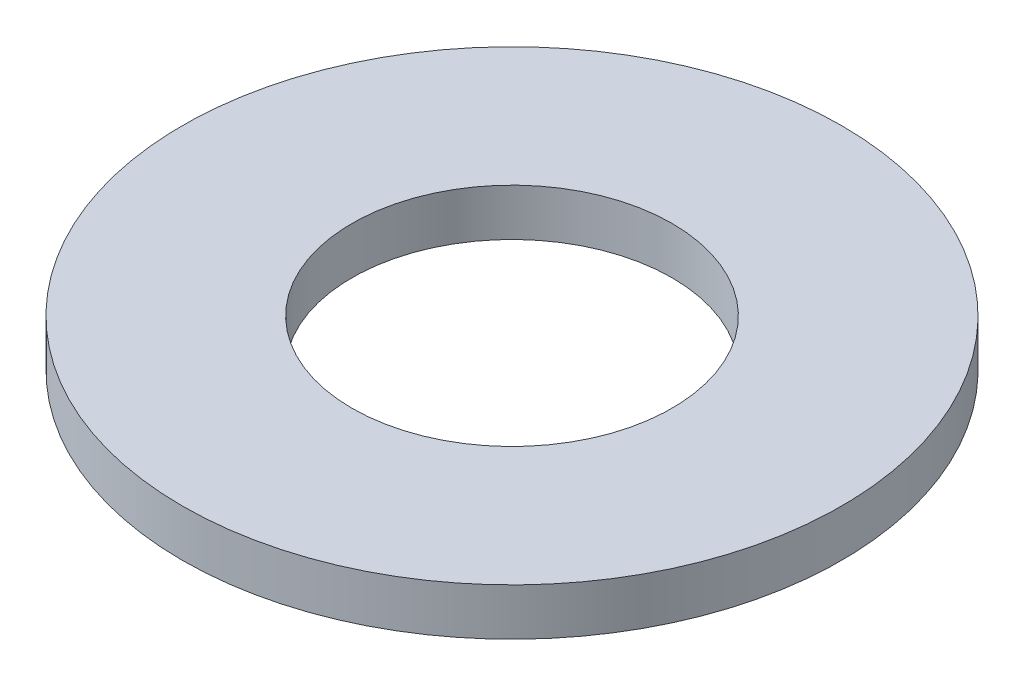
from build123d import *

# Parameters (mm, degrees)
BASE_OUTLINE_SKETCH_R   = 3.5
BASE_OUTLINE_SKETCH_R_2 = 1.7
BASE_OUTLINE_DEPTH      = 0.5


with BuildPart() as part:
    # Base Outline Sketch → Base Outline (new body)
    with BuildSketch(Plane(origin=(0, -157.5, 0), x_dir=(1, 0, 0), z_dir=(0, 1, 0))):
        with Locations(Location((-56.291651246, -50, 0), (0, 0, 270))):
            Circle(BASE_OUTLINE_SKETCH_R)
        with Locations(Location((-56.291651246, -50, 0), (0, 0, 270))):
            Circle(BASE_OUTLINE_SKETCH_R_2, mode=Mode.SUBTRACT)
    extrude(amount=BASE_OUTLINE_DEPTH)


solid = part.part
